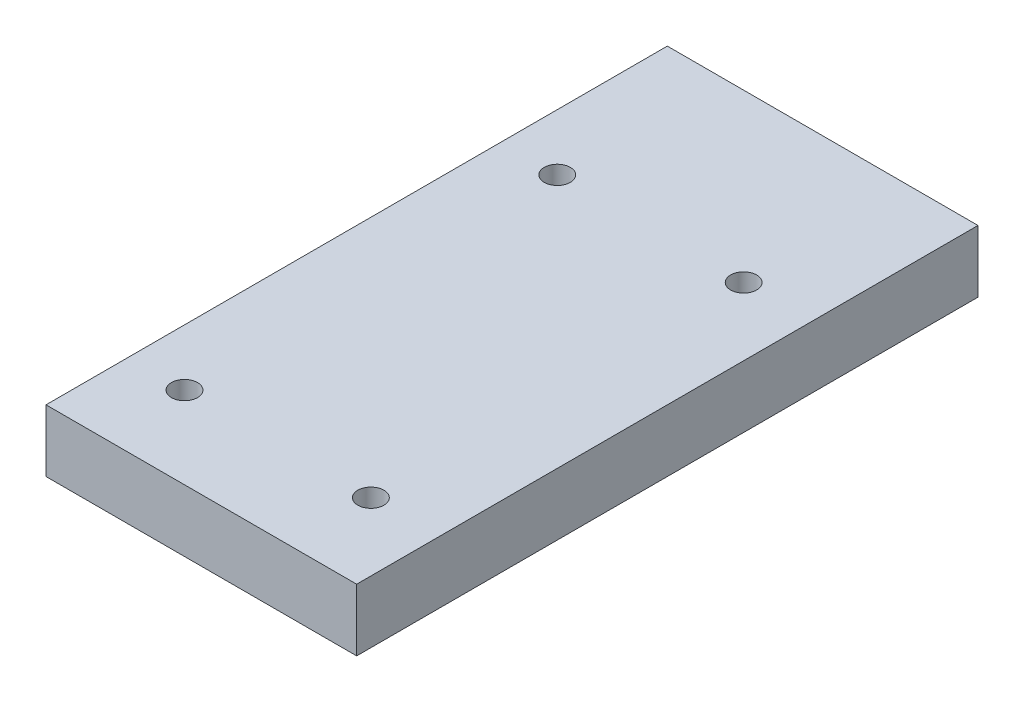
from build123d import *

# Parameters (mm, degrees)
SKETCH3_W               = 25
SKETCH3_H               = 50
BOSS_EXTRUDE2_DEPTH     = 5
CUT_EXTRUDE3_DEPTH      = 57.124860802
CUT_EXTRUDE3_DEPTH_BACK = 57.124860802
SKETCH4_R               = 1.05


with BuildPart() as part:
    # Sketch3 → Boss-Extrude2 (new body)
    with BuildSketch(Plane(origin=(0, 0, 0), x_dir=(1, 0, 0), z_dir=(0, 1, 0))):
        with Locations((12.5, 25)):
            Rectangle(SKETCH3_W, SKETCH3_H)
    extrude(amount=BOSS_EXTRUDE2_DEPTH)

    # Sketch4 → Cut-Extrude3 (cut, two sides: drawn at the far end of the back side and taken through both)
    with BuildSketch(Plane(origin=(0, 0, 0), x_dir=(1, 0, 0), z_dir=(0, 1, 0)).offset(-CUT_EXTRUDE3_DEPTH_BACK)):
        with Locations(Location((4.546150035, 6.596756963, 0), (0, 0, 270))):
            Circle(SKETCH4_R)
        with Locations(Location((4.546150035, 36.596756963, 0), (0, 0, 270))):
            Circle(SKETCH4_R)
        with Locations(Location((19.546150035, 36.596756963, 0), (0, 0, 270))):
            Circle(SKETCH4_R)
        with Locations(Location((19.546150035, 6.596756963, 0), (0, 0, 270))):
            Circle(SKETCH4_R)
    extrude(amount=CUT_EXTRUDE3_DEPTH + CUT_EXTRUDE3_DEPTH_BACK, mode=Mode.SUBTRACT)


solid = part.part
